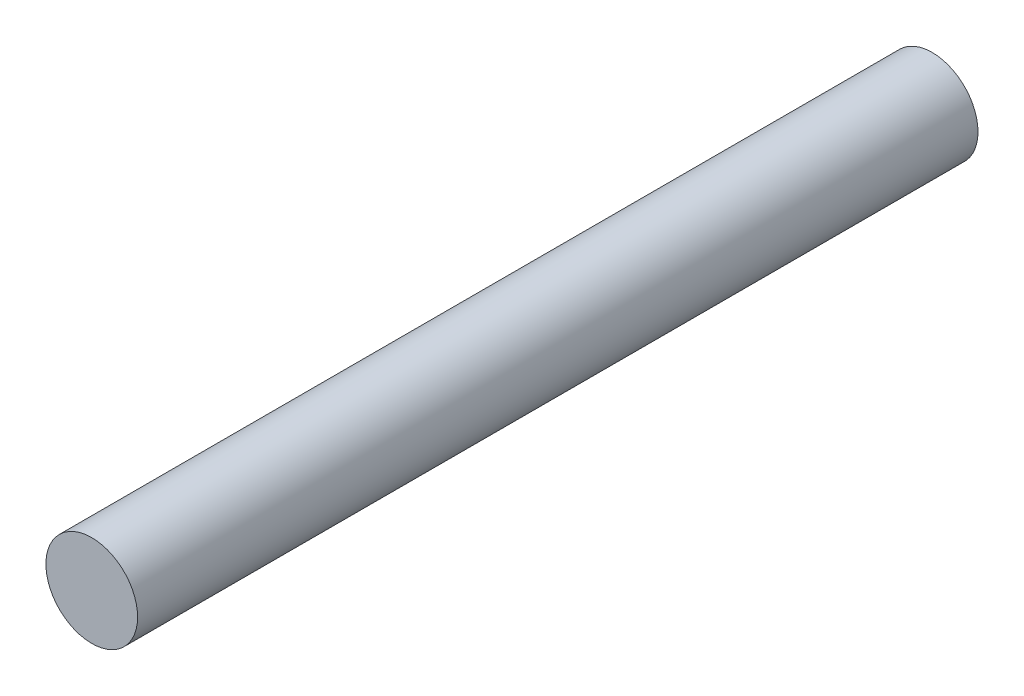
from build123d import *

# Parameters (mm, degrees)
ESQUISSE1_R        = 3
BOSS_EXTRU_1_DEPTH = 55


with BuildPart() as part:
    # Esquisse1 → Boss.-Extru.1 (new body)
    with BuildSketch(Plane.XY):
        Circle(ESQUISSE1_R)
    extrude(amount=BOSS_EXTRU_1_DEPTH)


solid = part.part
